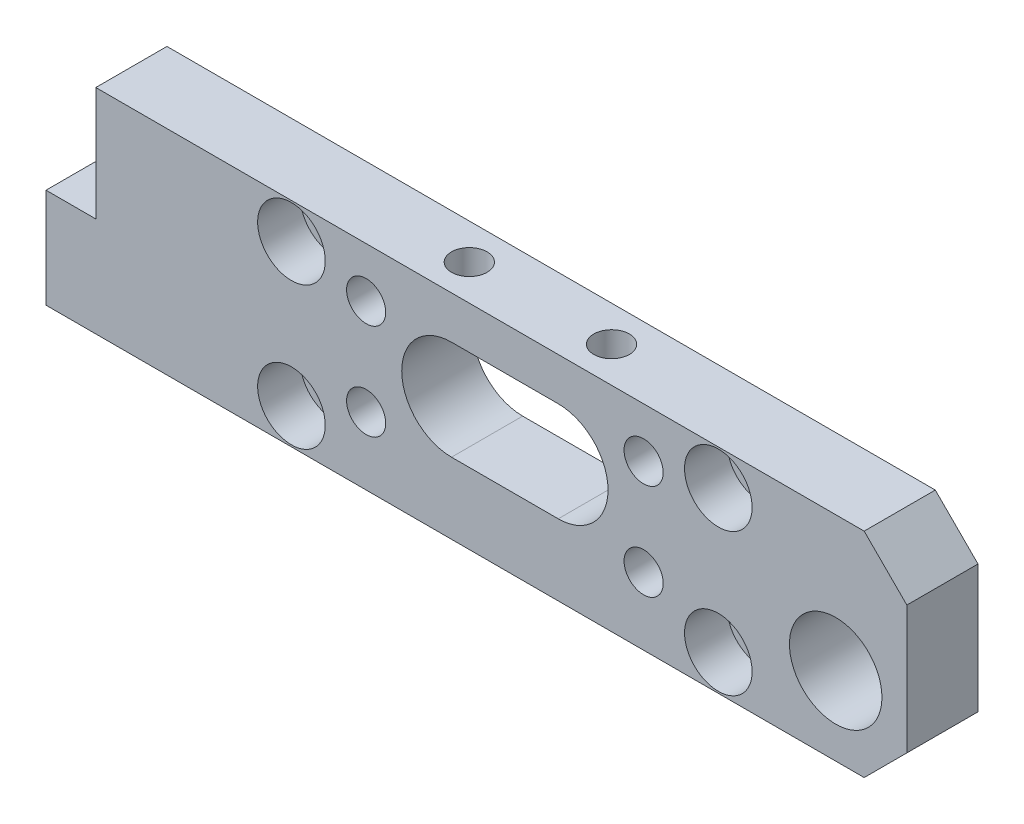
from build123d import *

# Parameters (mm, degrees)
SKETCH_1_R          = 2.75
SKETCH_1_R_2        = 6.5
EXTRUDE_1_DEPTH     = 10
SKETCH_2_R          = 4.75
CUT_EXTRUDE_2_DEPTH = 6
SKETCH_3_R          = 4.75
CUT_EXTRUDE_3_DEPTH = 6
CUT_EXTRUDE_4_REACH = 1574.343
SKETCH_4_R          = 2.5


with BuildPart() as part:
    # 草图1 → 拉伸1 (new body)
    with BuildSketch(Plane.XY):
        Polygon((1458.024528538, 1041.679154631), (1458.024528538, 1025.679154631), (1451.024528538, 1025.679154631), (1451.024528538, 1011.679154631), (1566.024528538, 1011.679154631), (1572.024528538, 1017.679154631), (1572.024528538, 1035.679154631), (1566.024528538, 1041.679154631), align=None)
        with Locations((1545.524528538, 1016.679154631)):
            Circle(SKETCH_1_R, mode=Mode.SUBTRACT)
        with Locations((1485.524528538, 1016.679154631)):
            Circle(SKETCH_1_R, mode=Mode.SUBTRACT)
        with Locations((1485.524528538, 1036.679154631)):
            Circle(SKETCH_1_R, mode=Mode.SUBTRACT)
        with Locations((1545.524528538, 1036.679154631)):
            Circle(SKETCH_1_R, mode=Mode.SUBTRACT)
        with Locations((1496.024528538, 1021.179154631)):
            Circle(SKETCH_1_R, mode=Mode.SUBTRACT)
        with Locations((1535.024528538, 1021.179154631)):
            Circle(SKETCH_1_R, mode=Mode.SUBTRACT)
        with Locations((1535.024528538, 1034.679154631)):
            Circle(SKETCH_1_R, mode=Mode.SUBTRACT)
        with Locations((1496.024528538, 1034.679154631)):
            Circle(SKETCH_1_R, mode=Mode.SUBTRACT)
        with Locations((1562.024528538, 1022.679154631)):
            Circle(SKETCH_1_R_2, mode=Mode.SUBTRACT)
        with BuildLine():
            Line((1508.024528538, 1035.679154631), (1523.024528538, 1035.679154631))
            ThreePointArc((1523.024528538, 1035.679154631), (1530.024528538, 1028.679154631), (1523.024528538, 1021.679154631))
            Line((1523.024528538, 1021.679154631), (1508.024528538, 1021.679154631))
            ThreePointArc((1508.024528538, 1021.679154631), (1501.024528538, 1028.679154631), (1508.024528538, 1035.679154631))
        make_face(mode=Mode.SUBTRACT)
    extrude(amount=EXTRUDE_1_DEPTH)

    # 草图2 → 拉伸2 (cut)
    with BuildSketch(Plane.XY.offset(10)):
        with Locations((1485.524528538, 1036.679154631)):
            Circle(SKETCH_2_R)
        with Locations((1545.524528538, 1036.679154631)):
            Circle(SKETCH_2_R)
        with Locations((1485.524528538, 1016.679154631)):
            Circle(SKETCH_2_R)
        with Locations((1545.524528538, 1016.679154631)):
            Circle(SKETCH_2_R)
    extrude(amount=-CUT_EXTRUDE_2_DEPTH, mode=Mode.SUBTRACT)

    # 草图3 → 拉伸3 (cut)
    with BuildSketch(Plane(origin=(0, 0, 0), x_dir=(-1, 0, 0), z_dir=(0, 0, -1))):
        with Locations((-1535.024528538, 1034.679154631)):
            Circle(SKETCH_3_R)
        with Locations((-1496.024528538, 1034.679154631)):
            Circle(SKETCH_3_R)
        with Locations((-1535.024528538, 1021.179154631)):
            Circle(SKETCH_3_R)
        with Locations((-1496.024528538, 1021.179154631)):
            Circle(SKETCH_3_R)
    extrude(amount=-CUT_EXTRUDE_3_DEPTH, mode=Mode.SUBTRACT)

    # 草图4 → 拉伸4 (cut, up to next)
    with BuildSketch(Plane(origin=(0, 1041.679154631, 0), x_dir=(1, 0, 0), z_dir=(0, 1, 0)), mode=Mode.PRIVATE) as cut_extrude_4_sk1:
        with Locations(Location((1505.524528538, -5, 0), (0, 0, 270))):
            Circle(SKETCH_4_R)
    cut_extrude_4_tool1 = extrude(cut_extrude_4_sk1.sketch, amount=-CUT_EXTRUDE_4_REACH, mode=Mode.PRIVATE) & part.part
    # 草图4 → 拉伸4 (cut, up to next)
    with BuildSketch(Plane(origin=(0, 1041.679154631, 0), x_dir=(1, 0, 0), z_dir=(0, 1, 0)), mode=Mode.PRIVATE) as cut_extrude_4_sk2:
        with Locations(Location((1525.524528538, -5, 0), (0, 0, 270))):
            Circle(SKETCH_4_R)
    cut_extrude_4_tool2 = extrude(cut_extrude_4_sk2.sketch, amount=-CUT_EXTRUDE_4_REACH, mode=Mode.PRIVATE) & part.part
    add(cut_extrude_4_tool1.solids().sort_by_distance((1505.524529, 1041.679155, 5))[0], mode=Mode.SUBTRACT)
    add(cut_extrude_4_tool2.solids().sort_by_distance((1525.524529, 1041.679155, 5))[0], mode=Mode.SUBTRACT)


solid = part.part
